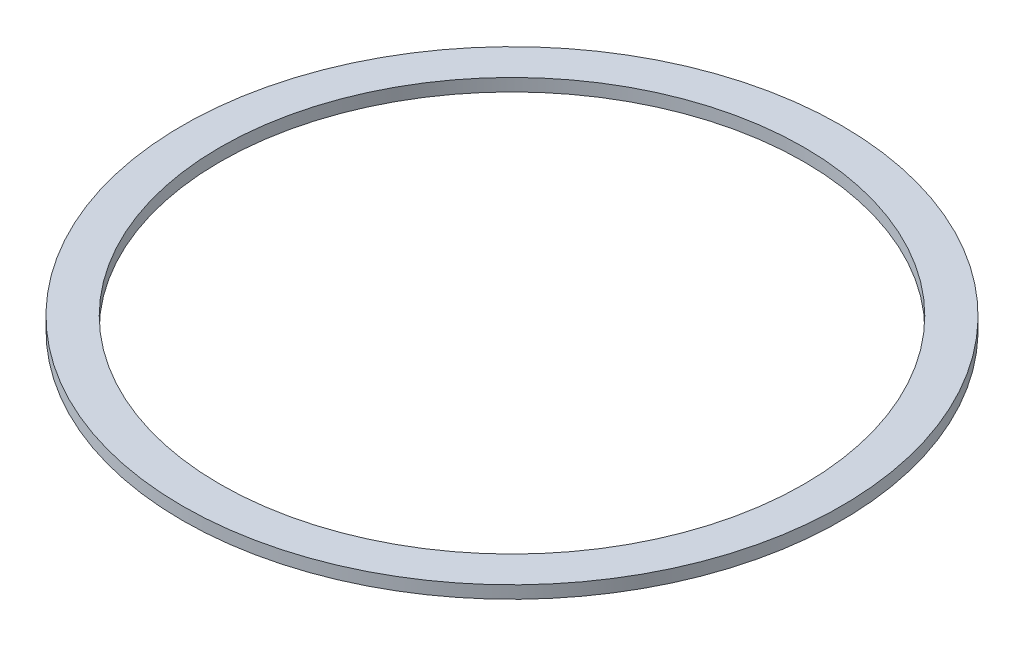
from build123d import *

# Parameters (mm, degrees)
SKETCH1_R           = 52.5
SKETCH1_R_2         = 46.5
BOSS_EXTRUDE1_DEPTH = 2


with BuildPart() as part:
    # Sketch1 → Boss-Extrude1 (new body)
    with BuildSketch(Plane(origin=(0, 0, 0), x_dir=(1, 0, 0), z_dir=(0, 1, 0))):
        with Locations(Location((0, 0, 0), (0, 0, 270))):
            Circle(SKETCH1_R)
        with Locations(Location((0, 0, 0), (0, 0, 270))):
            Circle(SKETCH1_R_2, mode=Mode.SUBTRACT)
    extrude(amount=BOSS_EXTRUDE1_DEPTH)


solid = part.part
